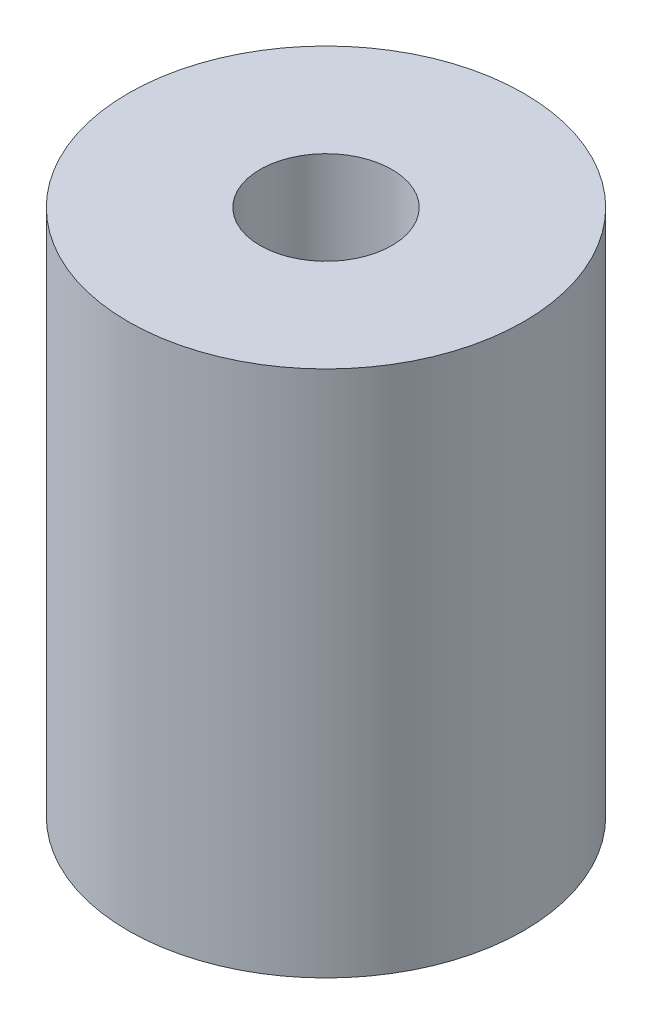
from build123d import *

# Parameters (mm, degrees)
SKETCH1_R           = 7.5
BOSS_EXTRUDE1_DEPTH = 20
SKETCH2_R           = 2.5
CUT_EXTRUDE1_DEPTH  = 10
SKETCH3_R           = 4
CUT_EXTRUDE2_DEPTH  = 10


with BuildPart() as part:
    # Sketch1 → Boss-Extrude1 (new body)
    with BuildSketch(Plane(origin=(0, 0, 0), x_dir=(1, 0, 0), z_dir=(0, 1, 0))):
        with Locations(Location((0, 0, 0), (0, 0, 270))):
            Circle(SKETCH1_R)
    extrude(amount=BOSS_EXTRUDE1_DEPTH)

    # Sketch2 → Cut-Extrude1 (cut)
    with BuildSketch(Plane(origin=(0, 20, 0), x_dir=(1, 0, 0), z_dir=(0, 1, 0))):
        with Locations(Location((0, 0, 0), (0, 0, 270))):
            Circle(SKETCH2_R)
    extrude(amount=-CUT_EXTRUDE1_DEPTH, mode=Mode.SUBTRACT)

    # Sketch3 → Cut-Extrude2 (cut)
    with BuildSketch(Plane.XZ):
        with Locations(Location((0, 0, 0), (0, 0, 270))):
            Circle(SKETCH3_R)
    extrude(amount=-CUT_EXTRUDE2_DEPTH, mode=Mode.SUBTRACT)


solid = part.part
